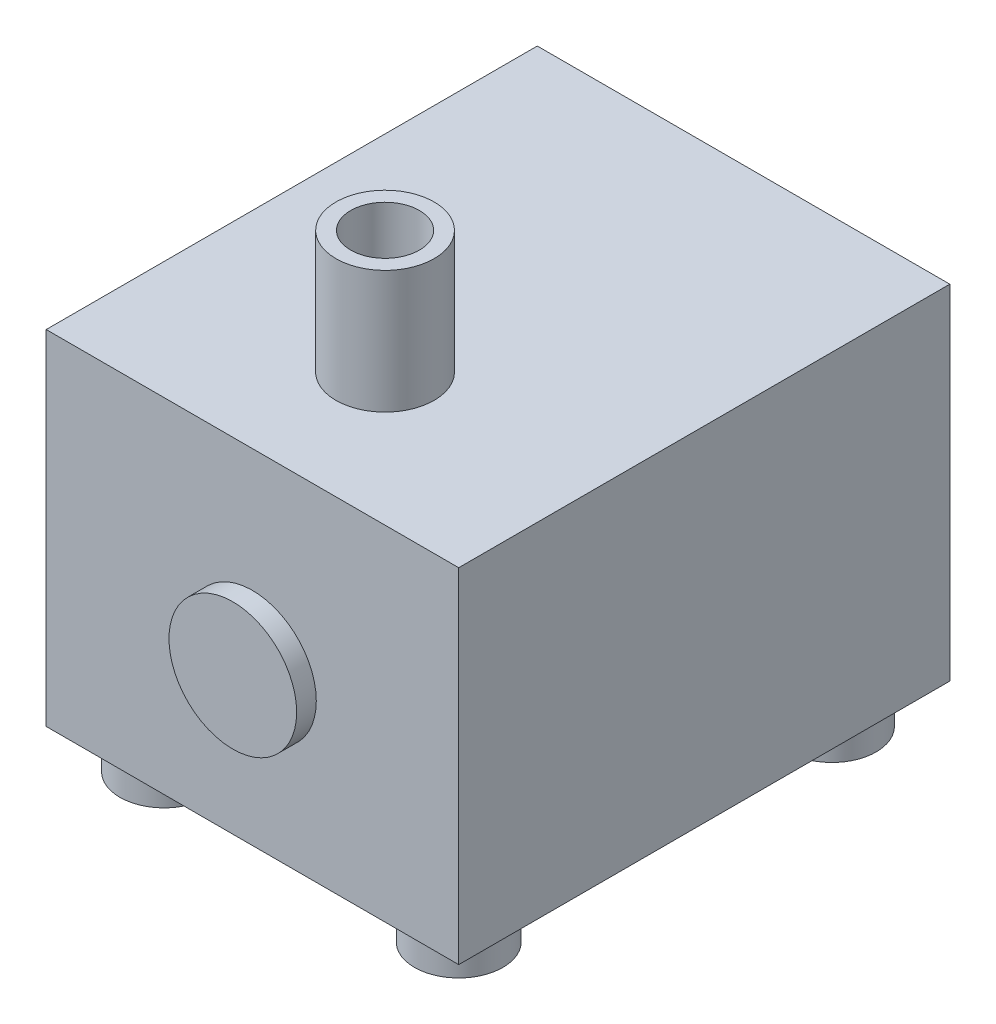
from build123d import *

# Parameters (mm, degrees)
LISTING_ENVELOPE_100X84X78_START     = 8
SKETCH1_W                            = 84
SKETCH1_H                            = 100
LISTING_ENVELOPE_100X84X78_DEPTH     = 70
SKETCH2_R                            = 9
SUCTION_FOOT_ASSUMED_DEPTH           = 8
SKETCH3_R                            = 9
BOSS_EXTRUDE3_DEPTH                  = 8
SKETCH4_R                            = 9
BOSS_EXTRUDE4_DEPTH                  = 8
SKETCH5_R                            = 9
BOSS_EXTRUDE5_DEPTH                  = 8
NOZZLE_EXTRA_CLEARANCE_ASSUMED_START = 78
SKETCH6_R                            = 10
SKETCH6_R_2                          = 7
NOZZLE_EXTRA_CLEARANCE_ASSUMED_DEPTH = 25
FLOW_ADJUSTMENT_KNOB_ASSUMED_START   = 50
SKETCH7_R                            = 13
FLOW_ADJUSTMENT_KNOB_ASSUMED_DEPTH   = 4


with BuildPart() as part:
    # Sketch1 → Listing_envelope_100x84x78 (new body)
    with BuildSketch(Plane(origin=(0, 0, 0), x_dir=(1, 0, 0), z_dir=(0, 1, 0)).offset(LISTING_ENVELOPE_100X84X78_START)):
        Rectangle(SKETCH1_W, SKETCH1_H)
    extrude(amount=LISTING_ENVELOPE_100X84X78_DEPTH)


with BuildPart() as body_2:
    # Sketch2 → Suction_foot_ASSUMED (new body)
    with BuildSketch(Plane(origin=(0, 0, 0), x_dir=(1, 0, 0), z_dir=(0, 1, 0))):
        with Locations(Location((-30, -38, 0), (0, 0, 270))):
            Circle(SKETCH2_R)
    extrude(amount=SUCTION_FOOT_ASSUMED_DEPTH)


with BuildPart() as body_3:
    # Sketch3 → Boss-Extrude3 (new body)
    with BuildSketch(Plane(origin=(0, 0, 0), x_dir=(1, 0, 0), z_dir=(0, 1, 0))):
        with Locations(Location((-30, 38, 0), (0, 0, 270))):
            Circle(SKETCH3_R)
    extrude(amount=BOSS_EXTRUDE3_DEPTH)


with BuildPart() as body_4:
    # Sketch4 → Boss-Extrude4 (new body)
    with BuildSketch(Plane(origin=(0, 0, 0), x_dir=(1, 0, 0), z_dir=(0, 1, 0))):
        with Locations(Location((30, -38, 0), (0, 0, 270))):
            Circle(SKETCH4_R)
    extrude(amount=BOSS_EXTRUDE4_DEPTH)


with BuildPart() as body_5:
    # Sketch5 → Boss-Extrude5 (new body)
    with BuildSketch(Plane(origin=(0, 0, 0), x_dir=(1, 0, 0), z_dir=(0, 1, 0))):
        with Locations(Location((30, 38, 0), (0, 0, 270))):
            Circle(SKETCH5_R)
    extrude(amount=BOSS_EXTRUDE5_DEPTH)


with BuildPart() as body_6:
    # Sketch6 → Nozzle_extra_clearance_ASSUMED (new body)
    with BuildSketch(Plane(origin=(0, 0, 0), x_dir=(1, 0, 0), z_dir=(0, 1, 0)).offset(NOZZLE_EXTRA_CLEARANCE_ASSUMED_START)):
        with Locations(Location((0, -23, 0), (0, 0, 270))):
            Circle(SKETCH6_R)
        with Locations(Location((0, -23, 0), (0, 0, 270))):
            Circle(SKETCH6_R_2, mode=Mode.SUBTRACT)
    extrude(amount=NOZZLE_EXTRA_CLEARANCE_ASSUMED_DEPTH)


with BuildPart() as body_7:
    # Sketch7 → Flow_adjustment_knob_ASSUMED (new body)
    with BuildSketch(Plane.XY.offset(FLOW_ADJUSTMENT_KNOB_ASSUMED_START)):
        with Locations((0, 40)):
            Circle(SKETCH7_R)
    extrude(amount=FLOW_ADJUSTMENT_KNOB_ASSUMED_DEPTH)


solid = Compound([part.part, body_2.part, body_3.part, body_4.part, body_5.part, body_6.part, body_7.part])
